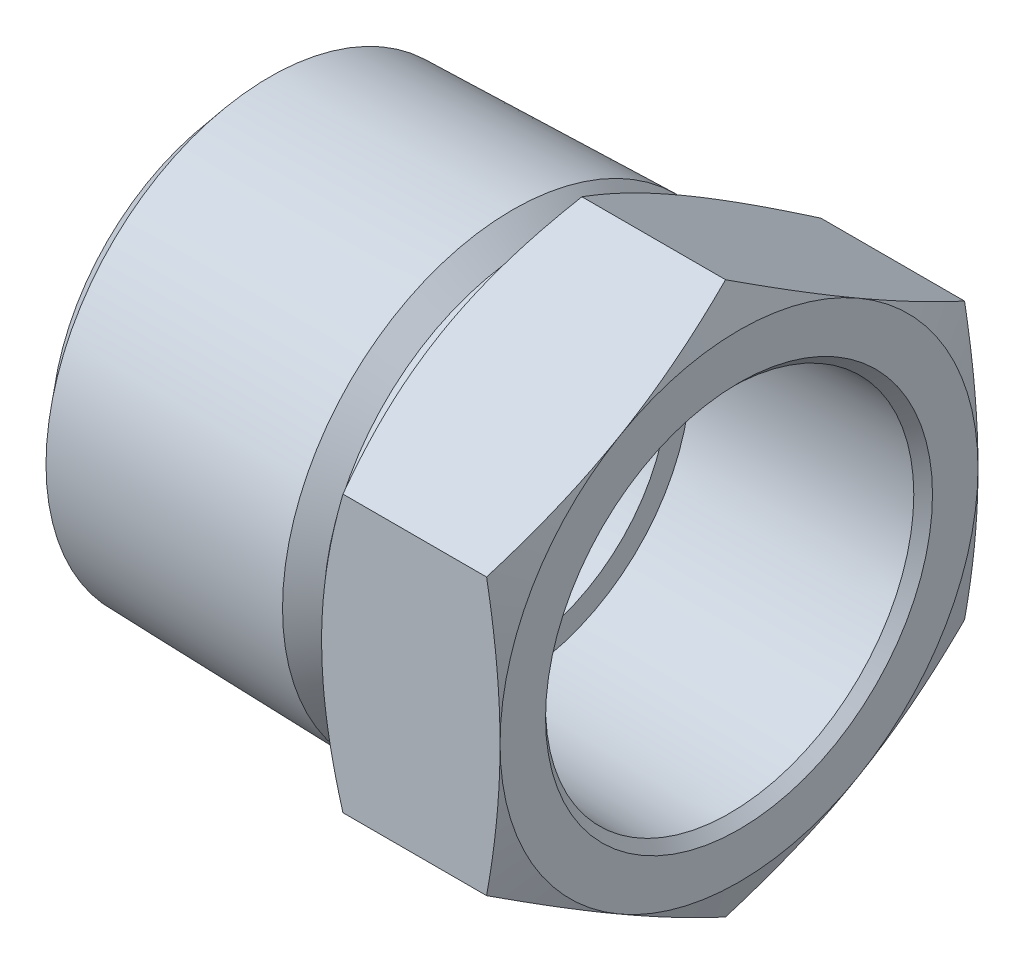
from build123d import *

# Parameters (mm, degrees)
SKETCH2_R          = 13.335
EXTRUDE1_DEPTH     = 19.05
EXTRUDE1_DRAFT     = -1.5
EXTRUDE2_DEPTH     = 10.668
SKETCH4_OUTSIDE_W  = 249.236
SKETCH4_OUTSIDE_H  = 253.656
SKETCH4_OUTSIDE_R  = 14.2875
CUT_EXTRUDE1_DEPTH = 37.870978496
CUT_EXTRUDE1_DRAFT = -70
SKETCH23_OUTSIDE_W = 144.954
SKETCH23_OUTSIDE_H = 149.374
SKETCH23_OUTSIDE_R = 14.2875
CUT_EXTRUDE7_DEPTH = 29.969156551
CUT_EXTRUDE7_DRAFT = -60
SKETCH15_R         = 10.668
CUT_EXTRUDE2_DEPTH = 28.15732722
CUT_EXTRUDE2_DRAFT = -1.5
SKETCH17_R         = 9.307285714
CUT_EXTRUDE3_DEPTH = 28.15732722
SKETCH18_R         = 11.567261543
CUT_EXTRUDE6_DEPTH = 6.35
CUT_EXTRUDE6_DRAFT = -45


with BuildPart() as part:
    # Sketch2 → Extrude1 (with draft: the straight prism first)
    with BuildSketch(Plane(origin=(-9.525, 0, 0), x_dir=(0, 0, -1), z_dir=(1, 0, 0))):
        Circle(SKETCH2_R)
    extrude(amount=EXTRUDE1_DEPTH)
    # Extrude1: the draft: its side faces are tilted about the plane it starts from
    extrude1_sides = [part.faces().sort_by_distance(p)[0] for p in [
        (0, 0, 13.335),
    ]]
    draft(extrude1_sides, Plane(origin=(-9.525, 0, 0), x_dir=(0, 0, -1), z_dir=(1, 0, 0)), EXTRUDE1_DRAFT)

    # Sketch8 → Cut-Revolve1 (revolve, cut)
    with BuildSketch(Plane.XY, mode=Mode.PRIVATE) as cut_revolve1_sk:
        Polygon((-9.525, 14.281645334), (-9.525, 11.394586861), (-7.1024703, 14.281645334), align=None)
        Polygon((9.525, 12.528428667), (9.525, 14.281645334), (6.13892619, 14.281645334), (7.892142857, 12.528428667), align=None)
    revolve(cut_revolve1_sk.sketch.rotate(Axis((-9.525, 0, 0), (1, 0, 0)), 270), axis=Axis((-9.525, 0, 0), (1, 0, 0)), mode=Mode.SUBTRACT)

    # Sketch3 → Extrude2 (add)
    with BuildSketch(Plane(origin=(9.525, 0, 0), x_dir=(0, 0, -1), z_dir=(1, 0, 0))):
        Polygon((14.2875, 8.248891971), (0, 16.497783942), (-14.2875, 8.248891971), (-14.2875, -8.248891971), (0, -16.497783942), (14.2875, -8.248891971), align=None)
    extrude(amount=EXTRUDE2_DEPTH)


with BuildPart() as cut_extrude1_tool:
    # Sketch4 outside → Cut-Extrude1 (with draft: the straight prism first)
    with BuildSketch(Plane(origin=(20.193, 0, 0), x_dir=(0, 0, -1), z_dir=(1, 0, 0))):
        Rectangle(SKETCH4_OUTSIDE_W, SKETCH4_OUTSIDE_H)
        Circle(SKETCH4_OUTSIDE_R, mode=Mode.SUBTRACT)
    extrude(amount=-CUT_EXTRUDE1_DEPTH)
    # Cut-Extrude1: the draft: its side faces are tilted about the plane it starts from
    cut_extrude1_sides = [cut_extrude1_tool.faces().sort_by_distance(p)[0] for p in [
        (1.257510752, -126.828, 0),
        (1.257510752, 0, -124.618),
        (1.257510752, 126.828, 0),
        (1.257510752, 0, 124.618),
        (1.257510752, 0, 14.2875),
    ]]
    draft(cut_extrude1_sides, Plane(origin=(20.193, 0, 0), x_dir=(0, 0, -1), z_dir=(1, 0, 0)), CUT_EXTRUDE1_DRAFT)


with BuildPart() as part_1:
    add(part.part)

    # Cut-Extrude1: cut by cut_extrude1_tool
    add(cut_extrude1_tool.part, mode=Mode.SUBTRACT)


with BuildPart() as cut_extrude7_tool:
    # Sketch23 outside → Cut-Extrude7 (with draft: the straight prism first)
    with BuildSketch(Plane.ZY.offset(-9.525)):
        Rectangle(SKETCH23_OUTSIDE_W, SKETCH23_OUTSIDE_H)
        Circle(SKETCH23_OUTSIDE_R, mode=Mode.SUBTRACT)
    extrude(amount=-CUT_EXTRUDE7_DEPTH)
    # Cut-Extrude7: the draft: its side faces are tilted about the plane it starts from
    cut_extrude7_sides = [cut_extrude7_tool.faces().sort_by_distance(p)[0] for p in [
        (24.509578275, -74.687, 0),
        (24.509578275, 0, 72.477),
        (24.509578275, 74.687, 0),
        (24.509578275, 0, -72.477),
        (24.509578275, 0, -14.2875),
    ]]
    draft(cut_extrude7_sides, Plane.ZY.offset(-9.525), CUT_EXTRUDE7_DRAFT)


with BuildPart() as part_2:
    add(part_1.part)

    # Cut-Extrude7: cut by cut_extrude7_tool
    add(cut_extrude7_tool.part, mode=Mode.SUBTRACT)


with BuildPart() as cut_extrude2_tool:
    # Sketch15 → Cut-Extrude2 (with draft: the straight prism first)
    with BuildSketch(Plane(origin=(6.63702, 0, 0), x_dir=(0, 0, -1), z_dir=(1, 0, 0))):
        Circle(SKETCH15_R)
    extrude(amount=CUT_EXTRUDE2_DEPTH)
    # Cut-Extrude2: the draft: its side faces are tilted about the plane it starts from
    cut_extrude2_sides = [cut_extrude2_tool.faces().sort_by_distance(p)[0] for p in [
        (20.71568361, 0, 10.668),
    ]]
    draft(cut_extrude2_sides, Plane(origin=(6.63702, 0, 0), x_dir=(0, 0, -1), z_dir=(1, 0, 0)), CUT_EXTRUDE2_DRAFT)


with BuildPart() as part_3:
    add(part_2.part)

    # Cut-Extrude2: cut by cut_extrude2_tool
    add(cut_extrude2_tool.part, mode=Mode.SUBTRACT)

    # Sketch17 → Cut-Extrude3 (cut, through all)
    with BuildSketch(Plane(origin=(6.63702, 0, 0), x_dir=(0, 0, -1), z_dir=(1, 0, 0))):
        Circle(SKETCH17_R)
    extrude(amount=-CUT_EXTRUDE3_DEPTH, mode=Mode.SUBTRACT)


with BuildPart() as cut_extrude6_tool:
    # Sketch18 → Cut-Extrude6 (with draft: the straight prism first)
    with BuildSketch(Plane(origin=(20.193, 0, 0), x_dir=(0, 0, -1), z_dir=(1, 0, 0))):
        Circle(SKETCH18_R)
    extrude(amount=-CUT_EXTRUDE6_DEPTH)
    # Cut-Extrude6: the draft: its side faces are tilted about the plane it starts from
    cut_extrude6_sides = [cut_extrude6_tool.faces().sort_by_distance(p)[0] for p in [
        (17.018, 0, 11.567261543),
    ]]
    draft(cut_extrude6_sides, Plane(origin=(20.193, 0, 0), x_dir=(0, 0, -1), z_dir=(1, 0, 0)), CUT_EXTRUDE6_DRAFT)


with BuildPart() as part_4:
    add(part_3.part)

    # Cut-Extrude6: cut by cut_extrude6_tool
    add(cut_extrude6_tool.part, mode=Mode.SUBTRACT)


solid = part_4.part
